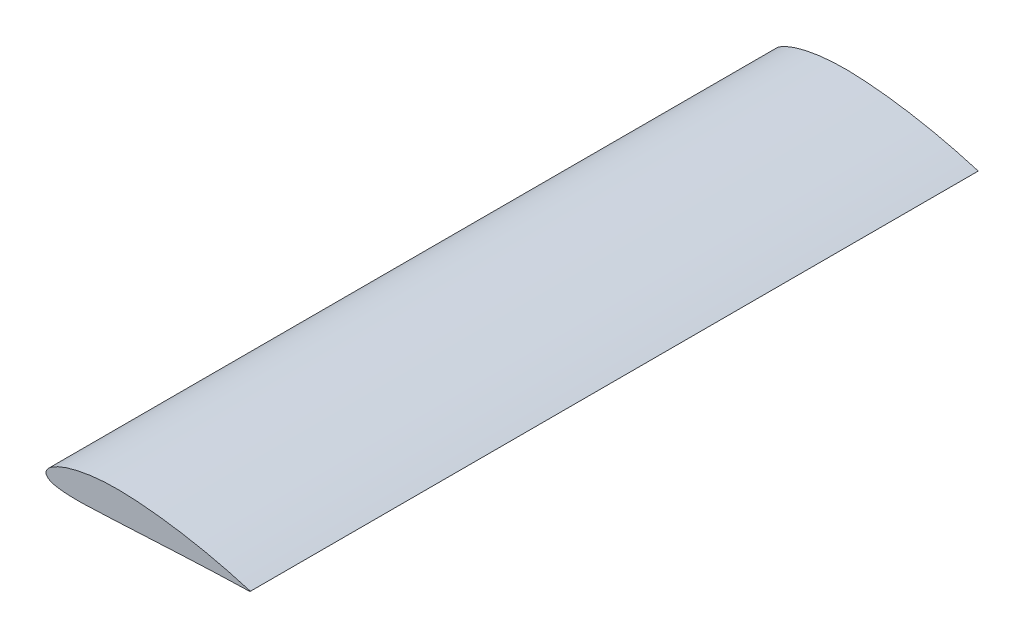
from build123d import *


with BuildPart() as part:
    # Sketch3 for Loft1 → Loft1 section 0
    with BuildSketch(Plane(origin=(0, 0, 0), x_dir=(0, 1, 0), z_dir=(0, 0, 1))):
        with BuildLine():
            # circular arc as an exact rational Bezier (weights 1, cos(half-angle), 1)
            Bezier((-0.202665083, -140.018796807), (-0.014300814, -140.750297279), (0.20398, -140.02716), weights=[1, 0.2692287, 1])
            add(Edge.make_bspline(
                [(0.20398, -140.02716), (0.225221614, -139.956789164), (0.310079495, -139.675665524), (0.499628043, -139.044498575), (0.811560708, -137.996224382), (1.240047695, -136.53643382), (1.777032141, -134.67290515), (2.412851873, -132.415637549), (3.1358864, -129.776846288), (3.933692953, -126.771112786), (4.792791861, -123.415248343), (5.698395621, -119.728052254), (6.636280332, -115.730741779), (7.591233715, -111.446385502), (8.548117776, -106.900008862), (9.492445349, -102.118559606), (10.409415786, -97.130634216), (11.284975564, -91.966410268), (12.105038568, -86.657412609), (12.857029979, -81.236388981), (13.527838574, -75.73710094), (14.106259972, -70.194232409), (14.581977397, -64.643046546), (14.944960369, -59.104498815), (15.193364145, -53.594982846), (15.253910921, -48.148650065), (15.131406496, -42.819494074), (14.82781174, -37.664538434), (14.35058458, -32.721013928), (13.711281299, -28.024385411), (12.924093156, -23.608012874), (12.006267835, -19.502621134), (10.977706191, -15.735911142), (9.859134477, -12.332541182), (8.673376074, -9.313184807), (7.442440069, -6.694904037), (6.187661477, -4.490555844), (4.9279798, -2.708401145), (3.676770633, -1.352289183), (2.439148295, -0.422250394), (1.201870147, 0.070443308), (-0.015542508, 0.077377809), (-1.134864491, -0.396195144), (-2.08980899, -1.313237948), (-2.890896356, -2.616641426), (-3.563173678, -4.297041235), (-4.116102548, -6.348001889), (-4.554504697, -8.759130798), (-4.882650098, -11.516006568), (-5.105809882, -14.601627618), (-5.230501095, -17.997318783), (-5.264786738, -21.683059084), (-5.218897023, -25.638080431), (-5.10415693, -29.840828227), (-4.933229134, -34.269214628), (-4.720159513, -38.900477027), (-4.479933199, -43.711199328), (-4.227521482, -48.677136592), (-3.97517313, -53.791929219), (-3.744332013, -59.043554579), (-3.480790248, -64.399799773), (-3.201291869, -69.810858587), (-2.91426609, -75.230102081), (-2.627552885, -80.625195825), (-2.347956216, -85.963681275), (-2.080447458, -91.213014836), (-1.829254509, -96.340917093), (-1.596711875, -101.315399412), (-1.384367436, -106.105239356), (-1.192880294, -110.67996384), (-1.021587896, -115.010291079), (-0.869967551, -119.068135992), (-0.736722937, -122.82702669), (-0.620892103, -126.262097545), (-0.521024926, -129.350471616), (-0.436344518, -132.071299287), (-0.365638747, -134.406136443), (-0.308592109, -136.338941963), (-0.264409061, -137.856451786), (-0.233117796, -138.948036515), (-0.214039877, -139.621406881), (-0.205204855, -139.93002458), (-0.202665083, -140.018796807)],
                knots=[0, 0, 0, 0, 0.000765131, 0.003056612, 0.006859659, 0.012149407, 0.018892533, 0.027046226, 0.036559371, 0.047371772, 0.059415781, 0.072616388, 0.086891657, 0.102152768, 0.118305464, 0.135250369, 0.152882702, 0.171093068, 0.189769869, 0.208797163, 0.22805825, 0.247433293, 0.26680299, 0.286048293, 0.305204433, 0.324202366, 0.342730632, 0.360679143, 0.377940972, 0.394414282, 0.410003847, 0.424621473, 0.43818735, 0.450630882, 0.461893566, 0.471931938, 0.480721044, 0.488262836, 0.494602303, 0.499854541, 0.50425718, 0.508228708, 0.512199848, 0.516588921, 0.521790217, 0.528017933, 0.535367186, 0.54386649, 0.553505569, 0.564252677, 0.576059862, 0.588869386, 0.602615469, 0.617228104, 0.632630672, 0.648744088, 0.665485528, 0.682767685, 0.700501138, 0.718789847, 0.737484302, 0.756321394, 0.775188473, 0.793972092, 0.812558004, 0.830832751, 0.84868312, 0.865998141, 0.882668481, 0.898589333, 0.913657957, 0.927777936, 0.94085676, 0.952808686, 0.963553789, 0.973020343, 0.981143405, 0.987868175, 0.993147616, 0.996945811, 0.999235114, 1.00015952, 1.00015952, 1.00015952, 1.00015952], degree=3))
        make_face()
    # Sketch4 for Loft1 → Loft1 section 1
    with BuildSketch(Plane(origin=(0, 0, 500), x_dir=(0, 1, 0), z_dir=(0, 0, 1))):
        with BuildLine():
            Bezier((-0.202665083, -140.018796807), (-0.014300814, -140.750297279), (0.20398, -140.02716), weights=[1, 0.2692287, 1])
            add(Edge.make_bspline(
                [(0.20398, -140.02716), (0.225221614, -139.956789164), (0.310079495, -139.675665524), (0.499628043, -139.044498575), (0.811560708, -137.996224382), (1.240047695, -136.53643382), (1.777032141, -134.67290515), (2.412851873, -132.415637549), (3.1358864, -129.776846288), (3.933692953, -126.771112786), (4.792791861, -123.415248343), (5.698395621, -119.728052254), (6.636280332, -115.730741779), (7.591233715, -111.446385502), (8.548117776, -106.900008862), (9.492445349, -102.118559606), (10.409415786, -97.130634216), (11.284975564, -91.966410268), (12.105038568, -86.657412609), (12.857029979, -81.236388981), (13.527838574, -75.73710094), (14.106259972, -70.194232409), (14.581977397, -64.643046546), (14.944960369, -59.104498815), (15.193364145, -53.594982846), (15.253910921, -48.148650065), (15.131406496, -42.819494074), (14.82781174, -37.664538434), (14.35058458, -32.721013928), (13.711281299, -28.024385411), (12.924093156, -23.608012874), (12.006267835, -19.502621134), (10.977706191, -15.735911142), (9.859134477, -12.332541182), (8.673376074, -9.313184807), (7.442440069, -6.694904037), (6.187661477, -4.490555844), (4.9279798, -2.708401145), (3.676770633, -1.352289183), (2.439148295, -0.422250394), (1.201870147, 0.070443308), (-0.015542508, 0.077377809), (-1.134864491, -0.396195144), (-2.08980899, -1.313237948), (-2.890896356, -2.616641426), (-3.563173678, -4.297041235), (-4.116102548, -6.348001889), (-4.554504697, -8.759130798), (-4.882650098, -11.516006568), (-5.105809882, -14.601627618), (-5.230501095, -17.997318783), (-5.264786738, -21.683059084), (-5.218897023, -25.638080431), (-5.10415693, -29.840828227), (-4.933229134, -34.269214628), (-4.720159513, -38.900477027), (-4.479933199, -43.711199328), (-4.227521482, -48.677136592), (-3.97517313, -53.791929219), (-3.744332013, -59.043554579), (-3.480790248, -64.399799773), (-3.201291869, -69.810858587), (-2.91426609, -75.230102081), (-2.627552885, -80.625195825), (-2.347956216, -85.963681275), (-2.080447458, -91.213014836), (-1.829254509, -96.340917093), (-1.596711875, -101.315399412), (-1.384367436, -106.105239356), (-1.192880294, -110.67996384), (-1.021587896, -115.010291079), (-0.869967551, -119.068135992), (-0.736722937, -122.82702669), (-0.620892103, -126.262097545), (-0.521024926, -129.350471616), (-0.436344518, -132.071299287), (-0.365638747, -134.406136443), (-0.308592109, -136.338941963), (-0.264409061, -137.856451786), (-0.233117796, -138.948036515), (-0.214039877, -139.621406881), (-0.205204855, -139.93002458), (-0.202665083, -140.018796807)],
                knots=[0, 0, 0, 0, 0.000765131, 0.003056612, 0.006859659, 0.012149407, 0.018892533, 0.027046226, 0.036559371, 0.047371772, 0.059415781, 0.072616388, 0.086891657, 0.102152768, 0.118305464, 0.135250369, 0.152882702, 0.171093068, 0.189769869, 0.208797163, 0.22805825, 0.247433293, 0.26680299, 0.286048293, 0.305204433, 0.324202366, 0.342730632, 0.360679143, 0.377940972, 0.394414282, 0.410003847, 0.424621473, 0.43818735, 0.450630882, 0.461893566, 0.471931938, 0.480721044, 0.488262836, 0.494602303, 0.499854541, 0.50425718, 0.508228708, 0.512199848, 0.516588921, 0.521790217, 0.528017933, 0.535367186, 0.54386649, 0.553505569, 0.564252677, 0.576059862, 0.588869386, 0.602615469, 0.617228104, 0.632630672, 0.648744088, 0.665485528, 0.682767685, 0.700501138, 0.718789847, 0.737484302, 0.756321394, 0.775188473, 0.793972092, 0.812558004, 0.830832751, 0.84868312, 0.865998141, 0.882668481, 0.898589333, 0.913657957, 0.927777936, 0.94085676, 0.952808686, 0.963553789, 0.973020343, 0.981143405, 0.987868175, 0.993147616, 0.996945811, 0.999235114, 1.00015952, 1.00015952, 1.00015952, 1.00015952], degree=3))
        make_face()
    loft()


solid = part.part
